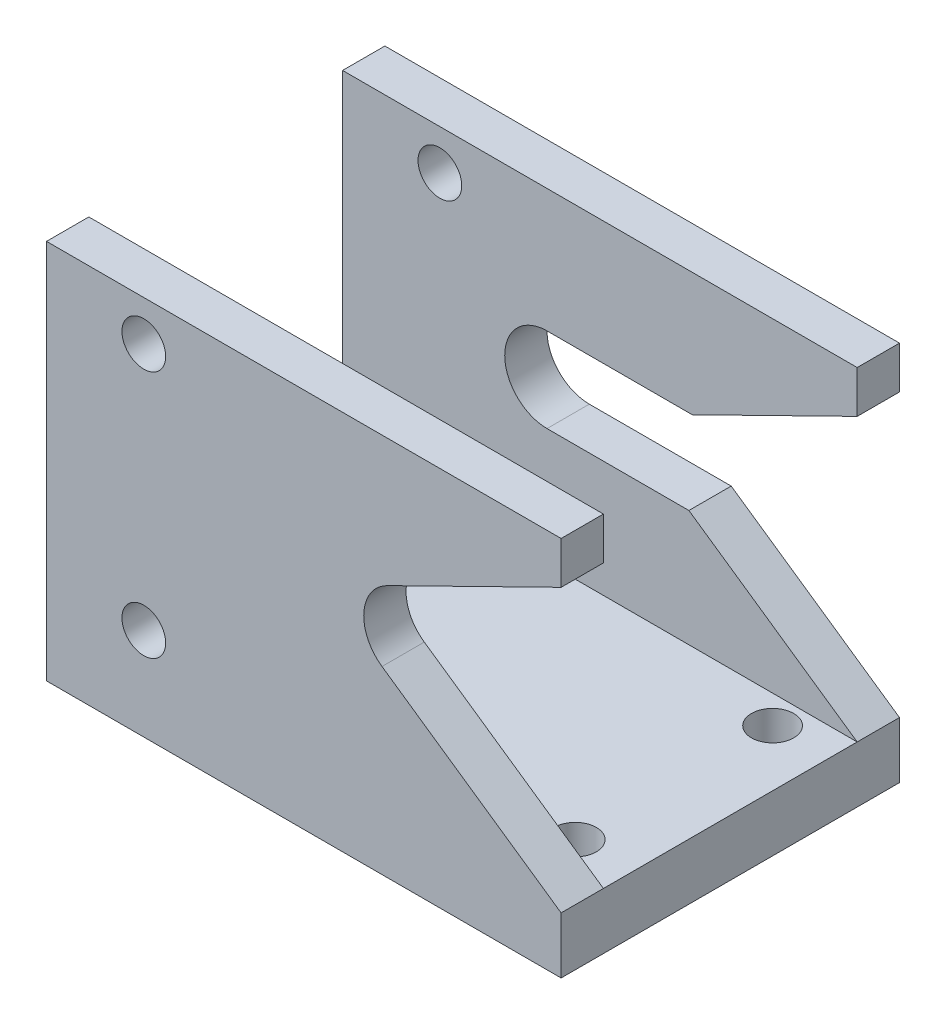
from build123d import *

# Parameters (mm, degrees)
SKETCH1_W           = 36.5
SKETCH1_H           = 24
BOSS_EXTRUDE1_DEPTH = 4
SKETCH2_W           = 36.5
SKETCH2_H           = 3
BOSS_EXTRUDE2_DEPTH = 23
SKETCH3_R           = 3
SKETCH3_R_2         = 1.55
CUT_EXTRUDE2_DEPTH  = 52.354162441
SKETCH6_R           = 1.5
CUT_EXTRUDE4_DEPTH  = 50.368512232
CUT_EXTRUDE5_REACH  = 53.354


with BuildPart() as part:
    # Sketch1 → Boss-Extrude1 (new body)
    with BuildSketch(Plane(origin=(0, 0, 0), x_dir=(1, 0, 0), z_dir=(0, 1, 0))):
        with Locations((18.25, 12)):
            Rectangle(SKETCH1_W, SKETCH1_H)
    extrude(amount=BOSS_EXTRUDE1_DEPTH)

    # Sketch2 → Boss-Extrude2 (add)
    with BuildSketch(Plane(origin=(0, 4, 0), x_dir=(1, 0, 0), z_dir=(0, 1, 0))):
        with Locations((18.25, 1.5)):
            Rectangle(SKETCH2_W, SKETCH2_H)
        with Locations((18.25, 22.5)):
            Rectangle(SKETCH2_W, SKETCH2_H)
    extrude(amount=BOSS_EXTRUDE2_DEPTH)

    # Sketch3 → Cut-Extrude2 (cut, through all)
    with BuildSketch(Plane.XY):
        with Locations((25.5, 15.25)):
            Circle(SKETCH3_R)
        with BuildLine():
            Line((36.5, 4), (36.5, 23.997165255))
            Line((36.5, 23.997165255), (24.17707002, 17.942555713))
            ThreePointArc((24.17707002, 17.942555713), (27.086065897, 17.79644752), (28.5, 15.25))
            ThreePointArc((28.5, 15.25), (26.893321833, 12.593187197), (23.794230487, 12.782136477))
            Line((23.794230487, 12.782136477), (36.5, 4))
        make_face()
        with Locations((6.9, 24.15)):
            Circle(SKETCH3_R_2)
        with Locations((6.9, 6.55)):
            Circle(SKETCH3_R_2)
    extrude(amount=-CUT_EXTRUDE2_DEPTH, mode=Mode.SUBTRACT)

    # Sketch6 → Cut-Extrude4 (cut, through all)
    with BuildSketch(Plane(origin=(0, 4, 0), x_dir=(1, 0, 0), z_dir=(0, 1, 0))):
        with Locations(Location((4, 19, 0), (0, 0, 270))):
            Circle(SKETCH6_R)
        with Locations(Location((32.5, 19, 0), (0, 0, 90))):
            Circle(SKETCH6_R)
        with Locations(Location((32.5, 5, 0), (0, 0, 270))):
            Circle(SKETCH6_R)
        with Locations(Location((4, 5, 0), (0, 0, 90))):
            Circle(SKETCH6_R)
    extrude(amount=-CUT_EXTRUDE4_DEPTH, mode=Mode.SUBTRACT)

    # Sketch8 → Cut-Extrude5 (cut, up to next)
    with BuildSketch(Plane(origin=(0, 0, -24), x_dir=(-1, 0, 0), z_dir=(0, 0, -1)), mode=Mode.PRIVATE) as cut_extrude5_sk1:
        with BuildLine():
            Line((-24.564111876, 12.25), (-14.5, 12.25))
            ThreePointArc((-14.5, 12.25), (-11.5, 15.25), (-14.5, 18.25))
            Line((-14.5, 18.25), (-24.802810523, 18.25))
            Line((-24.802810523, 18.25), (-24.17707002, 17.942555713))
            ThreePointArc((-24.17707002, 17.942555713), (-22.508221795, 15.471953085), (-23.794230487, 12.782136477))
            Line((-23.794230487, 12.782136477), (-24.564111876, 12.25))
        make_face()
    cut_extrude5_tool1 = extrude(cut_extrude5_sk1.sketch, amount=-CUT_EXTRUDE5_REACH, mode=Mode.PRIVATE) & part.part
    add(cut_extrude5_tool1.solids().sort_by_distance((17.630744, 15.252153, -24))[0], mode=Mode.SUBTRACT)


solid = part.part
